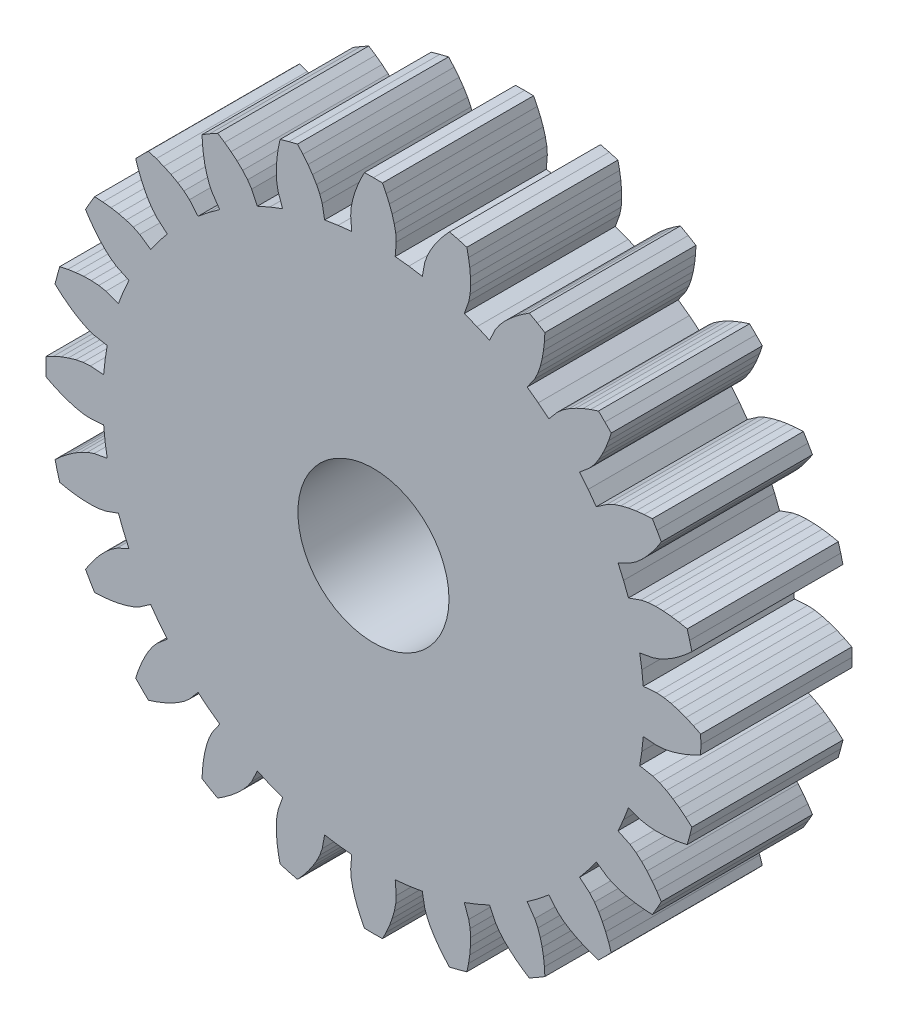
from build123d import *

# Parameters (mm, degrees)
EXTRUDE_START   = 22
SKETCH_1_R      = 6
EXTRUDE_1_DEPTH = 12


with BuildPart() as part:
    # 草图1 → 凸台-拉伸1 (new body)
    with BuildSketch(Plane.XY.offset(EXTRUDE_START)):
        Polygon((21.430626714, -1.725757417), (22.479853152, -1.810249127), (23.059433271, -1.768970852), (23.644115452, -1.651875042), (24.231034549, -1.48197918), (24.81856406, -1.26681943), (25.405350508, -1.010455248), (25.990154229, -0.715460109), (26, 0), (25.990154229, 0.715460109), (25.405350508, 1.010455248), (24.81856406, 1.26681943), (24.231034549, 1.48197918), (23.644115452, 1.651875042), (23.059433271, 1.768970852), (22.479853152, 1.810249127), (21.430626714, 1.725757417), (21.31606452, 2.806313133), (21.147054703, 3.879700683), (22.182397681, 4.069647743), (22.731545483, 4.259525868), (23.265998476, 4.523958619), (23.788946504, 4.83997126), (24.300768992, 5.199863446), (24.801209244, 5.599363739), (25.289735901, 6.035665503), (25.114071484, 6.729295173), (24.919386497, 7.417828296), (24.27815912, 7.551413379), (23.645015001, 7.647170656), (23.021817632, 7.702935188), (22.410925034, 7.715136148), (21.81585879, 7.676915131), (21.24534378, 7.566780511), (20.25373693, 7.213608001), (19.863409949, 8.227693796), (19.422345861, 9.220763593), (20.373248466, 9.672204844), (20.854540436, 9.99774294), (21.302342152, 10.391491976), (21.725681069, 10.832085657), (22.126916676, 11.312184221), (22.506906556, 11.82759534), (22.865863865, 12.375470485), (22.516660498, 13), (22.150403756, 13.614683744), (21.496451308, 13.577755168), (20.860097246, 13.506379839), (20.243701889, 13.398948892), (19.650467111, 13.252623476), (19.085569584, 13.061690332), (18.562999339, 12.807648307), (17.696588445, 12.209863121), (17.057096816, 13.088370724), (16.374036246, 13.933446702), (17.175696037, 14.61561717), (17.556332921, 15.054630352), (17.886966415, 15.550862328), (18.181846372, 16.086011317), (18.445151556, 16.653598336), (18.678795381, 17.249795865), (18.883720994, 17.871907605), (18.384776311, 18.384776311), (17.871907605, 18.883720994), (17.249795865, 18.678795381), (16.653598336, 18.445151556), (16.086011317, 18.181846372), (15.550862328, 17.886966415), (15.054630352, 17.556332921), (14.61561717, 17.175696037), (13.933446702, 16.374036246), (13.088370724, 17.057096816), (12.209863121, 17.696588445), (12.807648307, 18.562999339), (13.061690332, 19.085569584), (13.252623476, 19.650467111), (13.398948892, 20.243701889), (13.506379839, 20.860097246), (13.577755168, 21.496451308), (13.614683744, 22.150403756), (13, 22.516660498), (12.375470485, 22.865863865), (11.82759534, 22.506906556), (11.312184221, 22.126916676), (10.832085657, 21.725681069), (10.391491976, 21.302342152), (9.99774294, 20.854540436), (9.672204844, 20.373248466), (9.220763593, 19.422345861), (8.227693796, 19.863409949), (7.213608001, 20.25373693), (7.566780511, 21.24534378), (7.676915131, 21.81585879), (7.715136148, 22.410925034), (7.702935188, 23.021817632), (7.647170656, 23.645015001), (7.551413379, 24.27815912), (7.417828296, 24.919386497), (6.729295173, 25.114071484), (6.035665503, 25.289735901), (5.599363739, 24.801209244), (5.199863446, 24.300768992), (4.83997126, 23.788946504), (4.523958619, 23.265998476), (4.259525868, 22.731545483), (4.069647743, 22.182397681), (3.879700683, 21.147054703), (2.806313133, 21.31606452), (1.725757417, 21.430626714), (1.810249127, 22.479853152), (1.768970852, 23.059433271), (1.651875042, 23.644115452), (1.48197918, 24.231034549), (1.26681943, 24.81856406), (1.010455248, 25.405350508), (0.715460109, 25.990154229), (0, 26), (-0.715460109, 25.990154229), (-1.010455248, 25.405350508), (-1.26681943, 24.81856406), (-1.48197918, 24.231034549), (-1.651875042, 23.644115452), (-1.768970852, 23.059433271), (-1.810249127, 22.479853152), (-1.725757417, 21.430626714), (-2.806313133, 21.31606452), (-3.879700683, 21.147054703), (-4.069647743, 22.182397681), (-4.259525868, 22.731545483), (-4.523958619, 23.265998476), (-4.83997126, 23.788946504), (-5.199863446, 24.300768992), (-5.599363739, 24.801209244), (-6.035665503, 25.289735901), (-6.729295173, 25.114071484), (-7.417828296, 24.919386497), (-7.551413379, 24.27815912), (-7.647170656, 23.645015001), (-7.702935188, 23.021817632), (-7.715136148, 22.410925034), (-7.676915131, 21.81585879), (-7.566780511, 21.24534378), (-7.213608001, 20.25373693), (-8.227693796, 19.863409949), (-9.220763593, 19.422345861), (-9.672204844, 20.373248466), (-9.99774294, 20.854540436), (-10.391491976, 21.302342152), (-10.832085657, 21.725681069), (-11.312184221, 22.126916676), (-11.82759534, 22.506906556), (-12.375470485, 22.865863865), (-13, 22.516660498), (-13.614683744, 22.150403756), (-13.577755168, 21.496451308), (-13.506379839, 20.860097246), (-13.398948892, 20.243701889), (-13.252623476, 19.650467111), (-13.061690332, 19.085569584), (-12.807648307, 18.562999339), (-12.209863121, 17.696588445), (-13.088370724, 17.057096816), (-13.933446702, 16.374036246), (-14.61561717, 17.175696037), (-15.054630352, 17.556332921), (-15.550862328, 17.886966415), (-16.086011317, 18.181846372), (-16.653598336, 18.445151556), (-17.249795865, 18.678795381), (-17.871907605, 18.883720994), (-18.384776311, 18.384776311), (-18.883720994, 17.871907605), (-18.678795381, 17.249795865), (-18.445151556, 16.653598336), (-18.181846372, 16.086011317), (-17.886966415, 15.550862328), (-17.556332921, 15.054630352), (-17.175696037, 14.61561717), (-16.374036246, 13.933446702), (-17.057096816, 13.088370724), (-17.696588445, 12.209863121), (-18.562999339, 12.807648307), (-19.085569584, 13.061690332), (-19.650467111, 13.252623476), (-20.243701889, 13.398948892), (-20.860097246, 13.506379839), (-21.496451308, 13.577755168), (-22.150403756, 13.614683744), (-22.516660498, 13), (-22.865863865, 12.375470485), (-22.506906556, 11.82759534), (-22.126916676, 11.312184221), (-21.725681069, 10.832085657), (-21.302342152, 10.391491976), (-20.854540436, 9.99774294), (-20.373248466, 9.672204844), (-19.422345861, 9.220763593), (-19.863409949, 8.227693796), (-20.25373693, 7.213608001), (-21.24534378, 7.566780511), (-21.81585879, 7.676915131), (-22.410925034, 7.715136148), (-23.021817632, 7.702935188), (-23.645015001, 7.647170656), (-24.27815912, 7.551413379), (-24.919386497, 7.417828296), (-25.114071484, 6.729295173), (-25.289735901, 6.035665503), (-24.801209244, 5.599363739), (-24.300768992, 5.199863446), (-23.788946504, 4.83997126), (-23.265998476, 4.523958619), (-22.731545483, 4.259525868), (-22.182397681, 4.069647743), (-21.147054703, 3.879700683), (-21.31606452, 2.806313133), (-21.430626714, 1.725757417), (-22.479853152, 1.810249127), (-23.059433271, 1.768970852), (-23.644115452, 1.651875042), (-24.231034549, 1.48197918), (-24.81856406, 1.26681943), (-25.405350508, 1.010455248), (-25.990154229, 0.715460109), (-26, 0), (-25.990154229, -0.715460109), (-25.405350508, -1.010455248), (-24.81856406, -1.26681943), (-24.231034549, -1.48197918), (-23.644115452, -1.651875042), (-23.059433271, -1.768970852), (-22.479853152, -1.810249127), (-21.430626714, -1.725757417), (-21.31606452, -2.806313133), (-21.147054703, -3.879700683), (-22.182397681, -4.069647743), (-22.731545483, -4.259525868), (-23.265998476, -4.523958619), (-23.788946504, -4.83997126), (-24.300768992, -5.199863446), (-24.801209244, -5.599363739), (-25.289735901, -6.035665503), (-25.114071484, -6.729295173), (-24.919386497, -7.417828296), (-24.27815912, -7.551413379), (-23.645015001, -7.647170656), (-23.021817632, -7.702935188), (-22.410925034, -7.715136148), (-21.81585879, -7.676915131), (-21.24534378, -7.566780511), (-20.25373693, -7.213608001), (-19.863409949, -8.227693796), (-19.422345861, -9.220763593), (-20.373248466, -9.672204844), (-20.854540436, -9.99774294), (-21.302342152, -10.391491976), (-21.725681069, -10.832085657), (-22.126916676, -11.312184221), (-22.506906556, -11.82759534), (-22.865863865, -12.375470485), (-22.516660498, -13), (-22.150403756, -13.614683744), (-21.496451308, -13.577755168), (-20.860097246, -13.506379839), (-20.243701889, -13.398948892), (-19.650467111, -13.252623476), (-19.085569584, -13.061690332), (-18.562999339, -12.807648307), (-17.696588445, -12.209863121), (-17.057096816, -13.088370724), (-16.374036246, -13.933446702), (-17.175696037, -14.61561717), (-17.556332921, -15.054630352), (-17.886966415, -15.550862328), (-18.181846372, -16.086011317), (-18.445151556, -16.653598336), (-18.678795381, -17.249795865), (-18.883720994, -17.871907605), (-18.384776311, -18.384776311), (-17.871907605, -18.883720994), (-17.249795865, -18.678795381), (-16.653598336, -18.445151556), (-16.086011317, -18.181846372), (-15.550862328, -17.886966415), (-15.054630352, -17.556332921), (-14.61561717, -17.175696037), (-13.933446702, -16.374036246), (-13.088370724, -17.057096816), (-12.209863121, -17.696588445), (-12.807648307, -18.562999339), (-13.061690332, -19.085569584), (-13.252623476, -19.650467111), (-13.398948892, -20.243701889), (-13.506379839, -20.860097246), (-13.577755168, -21.496451308), (-13.614683744, -22.150403756), (-13, -22.516660498), (-12.375470485, -22.865863865), (-11.82759534, -22.506906556), (-11.312184221, -22.126916676), (-10.832085657, -21.725681069), (-10.391491976, -21.302342152), (-9.99774294, -20.854540436), (-9.672204844, -20.373248466), (-9.220763593, -19.422345861), (-8.227693796, -19.863409949), (-7.213608001, -20.25373693), (-7.566780511, -21.24534378), (-7.676915131, -21.81585879), (-7.715136148, -22.410925034), (-7.702935188, -23.021817632), (-7.647170656, -23.645015001), (-7.551413379, -24.27815912), (-7.417828296, -24.919386497), (-6.729295173, -25.114071484), (-6.035665503, -25.289735901), (-5.599363739, -24.801209244), (-5.199863446, -24.300768992), (-4.83997126, -23.788946504), (-4.523958619, -23.265998476), (-4.259525868, -22.731545483), (-4.069647743, -22.182397681), (-3.879700683, -21.147054703), (-2.806313133, -21.31606452), (-1.725757417, -21.430626714), (-1.810249127, -22.479853152), (-1.768970852, -23.059433271), (-1.651875042, -23.644115452), (-1.48197918, -24.231034549), (-1.26681943, -24.81856406), (-1.010455248, -25.405350508), (-0.715460109, -25.990154229), (0, -26), (0.715460109, -25.990154229), (1.010455248, -25.405350508), (1.26681943, -24.81856406), (1.48197918, -24.231034549), (1.651875042, -23.644115452), (1.768970852, -23.059433271), (1.810249127, -22.479853152), (1.725757417, -21.430626714), (2.806313133, -21.31606452), (3.879700683, -21.147054703), (4.069647743, -22.182397681), (4.259525868, -22.731545483), (4.523958619, -23.265998476), (4.83997126, -23.788946504), (5.199863446, -24.300768992), (5.599363739, -24.801209244), (6.035665503, -25.289735901), (6.729295173, -25.114071484), (7.417828296, -24.919386497), (7.551413379, -24.27815912), (7.647170656, -23.645015001), (7.702935188, -23.021817632), (7.715136148, -22.410925034), (7.676915131, -21.81585879), (7.566780511, -21.24534378), (7.213608001, -20.25373693), (8.227693796, -19.863409949), (9.220763593, -19.422345861), (9.672204844, -20.373248466), (9.99774294, -20.854540436), (10.391491976, -21.302342152), (10.832085657, -21.725681069), (11.312184221, -22.126916676), (11.82759534, -22.506906556), (12.375470485, -22.865863865), (13, -22.516660498), (13.614683744, -22.150403756), (13.577755168, -21.496451308), (13.506379839, -20.860097246), (13.398948892, -20.243701889), (13.252623476, -19.650467111), (13.061690332, -19.085569584), (12.807648307, -18.562999339), (12.209863121, -17.696588445), (13.088370724, -17.057096816), (13.933446702, -16.374036246), (14.61561717, -17.175696037), (15.054630352, -17.556332921), (15.550862328, -17.886966415), (16.086011317, -18.181846372), (16.653598336, -18.445151556), (17.249795865, -18.678795381), (17.871907605, -18.883720994), (18.384776311, -18.384776311), (18.883720994, -17.871907605), (18.678795381, -17.249795865), (18.445151556, -16.653598336), (18.181846372, -16.086011317), (17.886966415, -15.550862328), (17.556332921, -15.054630352), (17.175696037, -14.61561717), (16.374036246, -13.933446702), (17.057096816, -13.088370724), (17.696588445, -12.209863121), (18.562999339, -12.807648307), (19.085569584, -13.061690332), (19.650467111, -13.252623476), (20.243701889, -13.398948892), (20.860097246, -13.506379839), (21.496451308, -13.577755168), (22.150403756, -13.614683744), (22.516660498, -13), (22.865863865, -12.375470485), (22.506906556, -11.82759534), (22.126916676, -11.312184221), (21.725681069, -10.832085657), (21.302342152, -10.391491976), (20.854540436, -9.99774294), (20.373248466, -9.672204844), (19.422345861, -9.220763593), (19.863409949, -8.227693796), (20.25373693, -7.213608001), (21.24534378, -7.566780511), (21.81585879, -7.676915131), (22.410925034, -7.715136148), (23.021817632, -7.702935188), (23.645015001, -7.647170656), (24.27815912, -7.551413379), (24.919386497, -7.417828296), (25.114071484, -6.729295173), (25.289735901, -6.035665503), (24.801209244, -5.599363739), (24.300768992, -5.199863446), (23.788946504, -4.83997126), (23.265998476, -4.523958619), (22.731545483, -4.259525868), (22.182397681, -4.069647743), (21.147054703, -3.879700683), (21.31606452, -2.806313133), align=None)
        Circle(SKETCH_1_R, mode=Mode.SUBTRACT)
    extrude(amount=EXTRUDE_1_DEPTH)


solid = part.part
